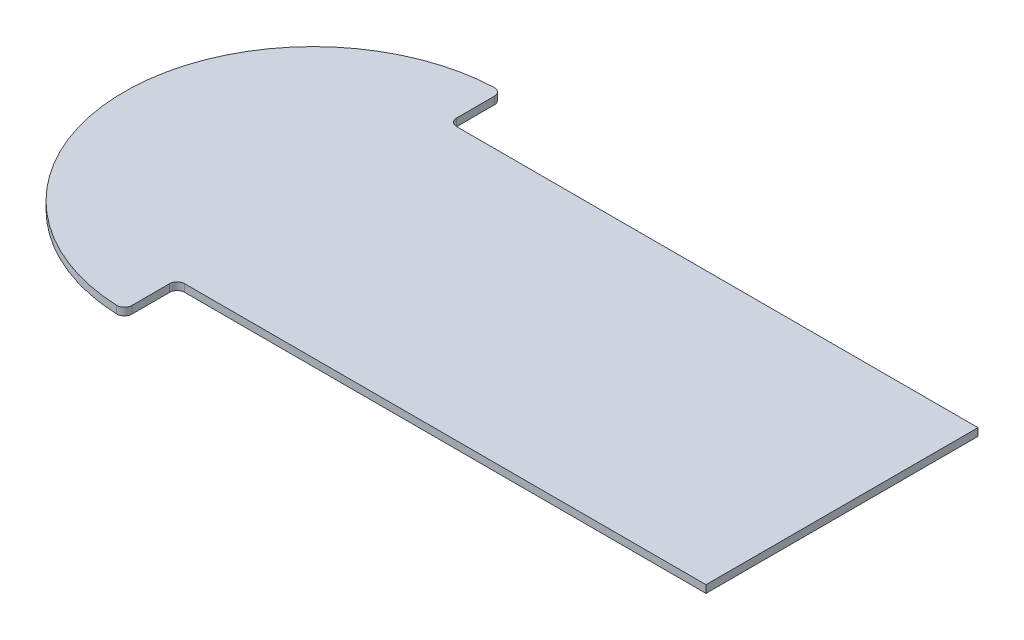
from build123d import *

# Parameters (mm, degrees)
SKETCH1_W           = 70
SKETCH1_H           = 36
BOSS_EXTRUDE1_DEPTH = 1
FILLET1_R           = 1


with BuildPart() as part:
    # Sketch1 → Boss-Extrude1 (new body)
    with BuildSketch(Plane(origin=(0, 0, 0), x_dir=(1, 0, 0), z_dir=(0, 1, 0))):
        with BuildLine():
            Line((-35, 25), (-35, 18))
            Line((-35, 18), (-35, -18))
            Line((-35, -18), (-35, -25))
            ThreePointArc((-35, -25), (-60, 0), (-35, 25))
        make_face()
        Rectangle(SKETCH1_W, SKETCH1_H)
    extrude(amount=BOSS_EXTRUDE1_DEPTH)

    # Fillet1
    fillet1_edges = [part.edges().sort_by_distance(p)[0] for p in [
        (-35, 0.5, -18),
        (-35, 0.5, 18),
        (-35, 0.5, 25),
        (-35, 0.5, -25),
    ]]
    fillet(fillet1_edges, radius=FILLET1_R)


solid = part.part
